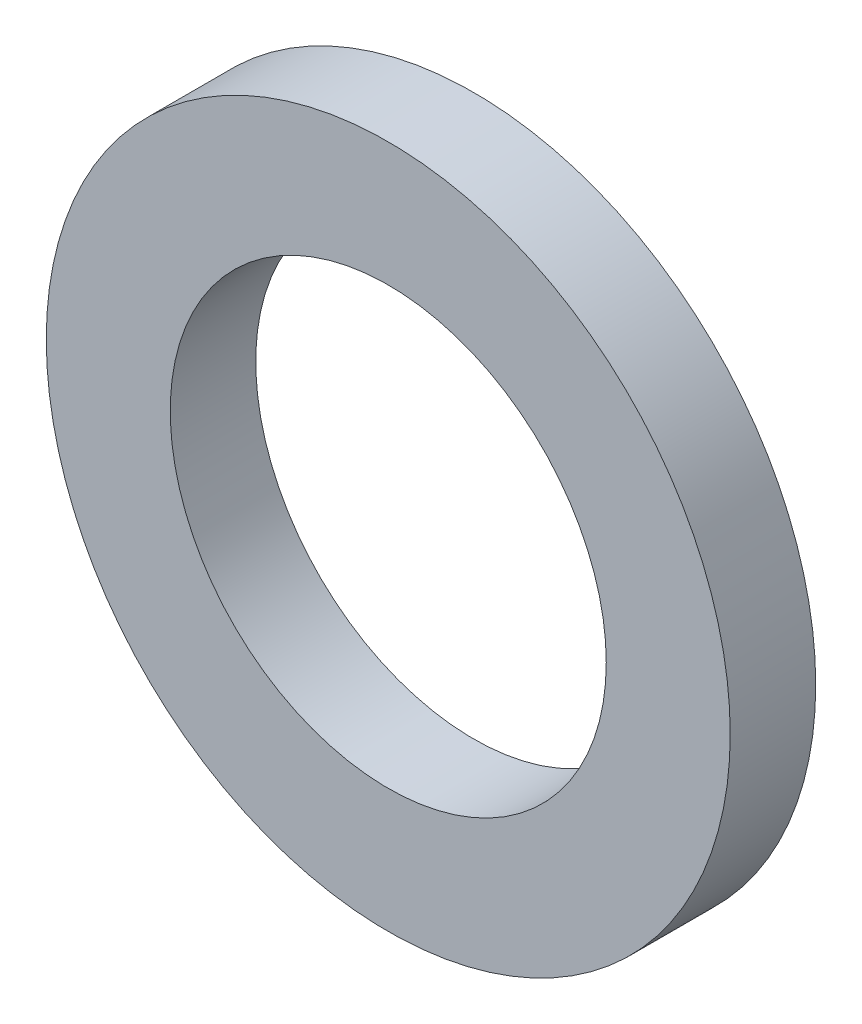
from build123d import *

# Parameters (mm, degrees)
ESBO_O1_R                = 4
ESBO_O1_R_2              = 2.55
RESSALTO_EXTRUS_O1_DEPTH = 1


with BuildPart() as part:
    # Esboço1 → Ressalto-extrusão1 (new body)
    with BuildSketch(Plane.XY):
        Circle(ESBO_O1_R)
        Circle(ESBO_O1_R_2, mode=Mode.SUBTRACT)
    extrude(amount=RESSALTO_EXTRUS_O1_DEPTH)


solid = part.part
